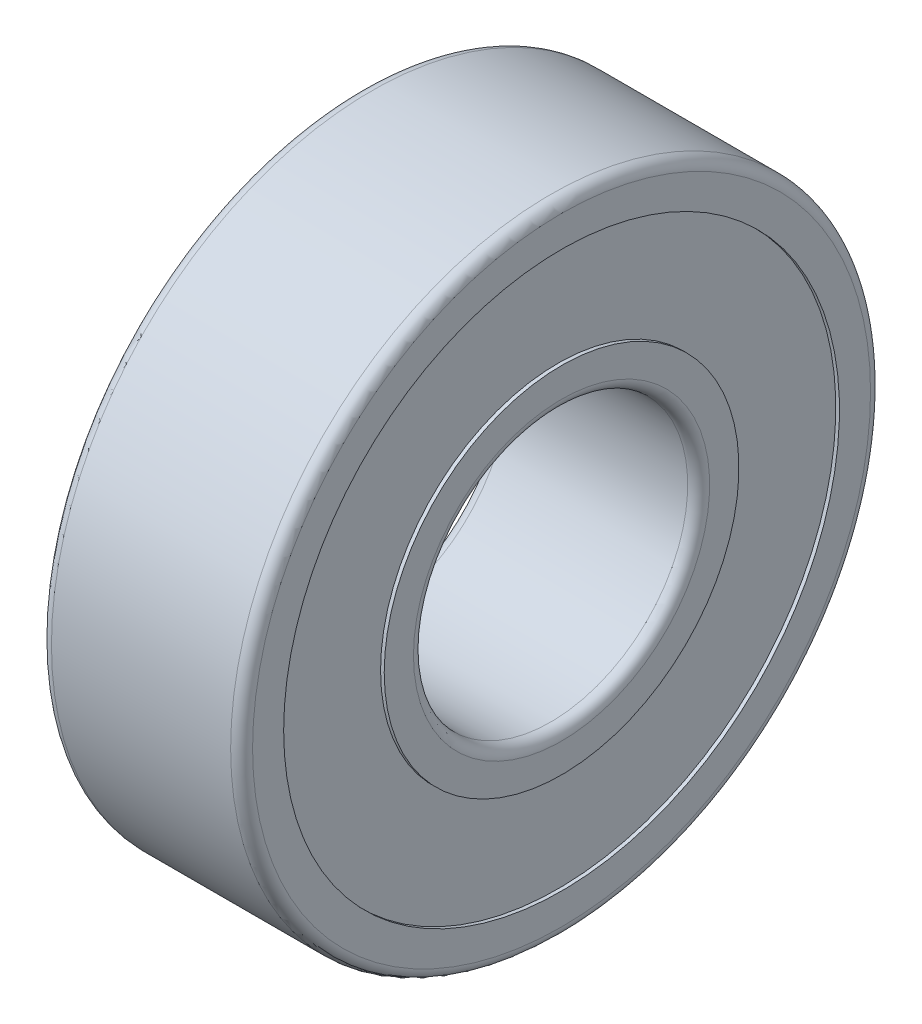
from build123d import *

# Parameters (mm, degrees)
FILLET1_R = 0.6


with BuildPart() as part:
    # Sketch1 → Revolve1 (revolve)
    with BuildSketch(Plane.XY, mode=Mode.PRIVATE) as revolve1_sk:
        Polygon((0, 9.7), (0, 7.5), (11, 7.5), (11, 9.7), (10.8, 9.7), (10.8, 15.2), (11, 15.2), (11, 17.5), (0, 17.5), (0, 15.2), (0.2, 15.2), (0.2, 9.7), align=None)
    revolve(revolve1_sk.sketch.rotate(Axis((0, 0, 0), (1, 0, 0)), 90), axis=Axis((0, 0, 0), (1, 0, 0)))

    # Fillet1
    fillet1_edges = [part.edges().sort_by_distance(p)[0] for p in [
        (11, 0, -17.5),
        (11, 0, -7.5),
        (0, 0, -7.5),
        (0, 0, -17.5),
    ]]
    fillet(fillet1_edges, radius=FILLET1_R)


solid = part.part
